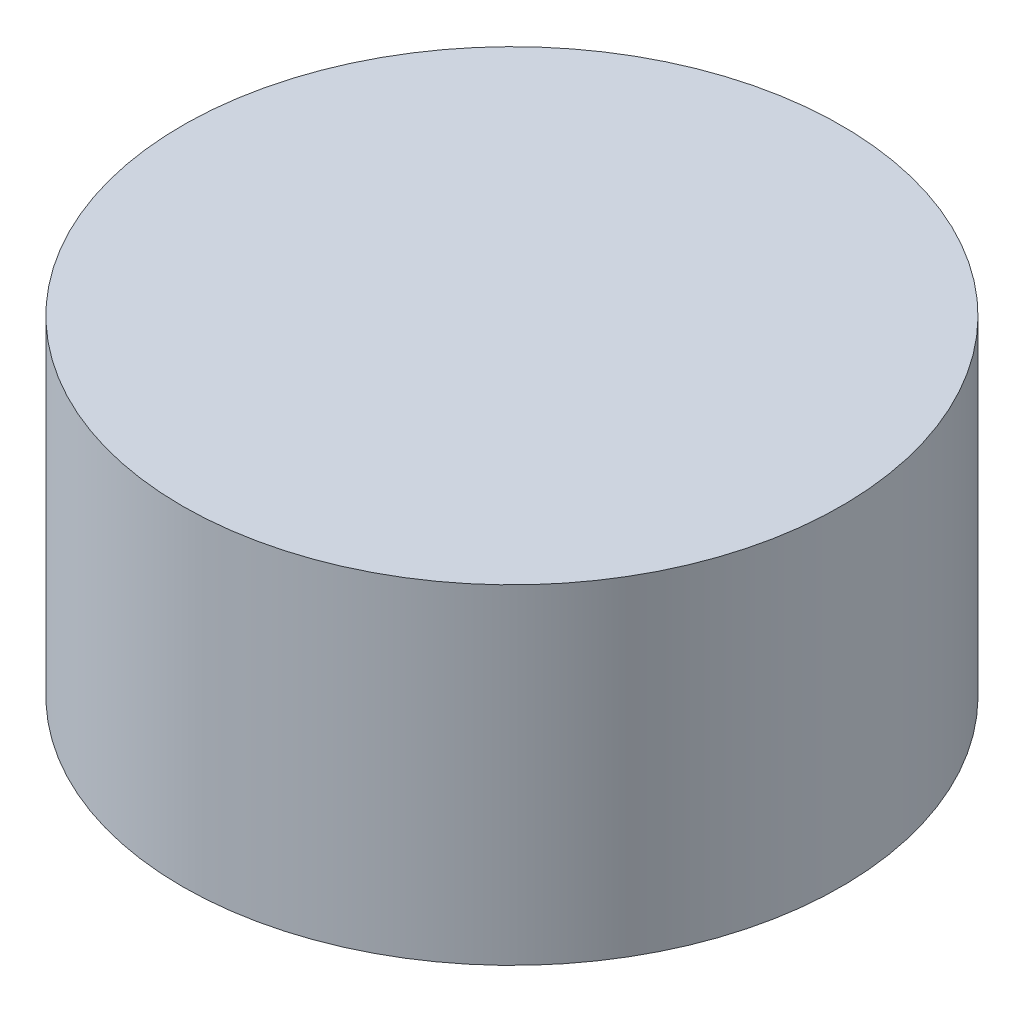
from build123d import *

# Parameters (mm, degrees)
SKETCH2_R           = 10
BOSS_EXTRUDE1_DEPTH = 10


with BuildPart() as part:
    # Sketch2 → Boss-Extrude1 (new body)
    with BuildSketch(Plane(origin=(0, 0, 0), x_dir=(1, 0, 0), z_dir=(0, 1, 0))):
        with Locations(Location((0, 0, 0), (0, 0, 270))):
            Circle(SKETCH2_R)
    extrude(amount=BOSS_EXTRUDE1_DEPTH)


solid = part.part
